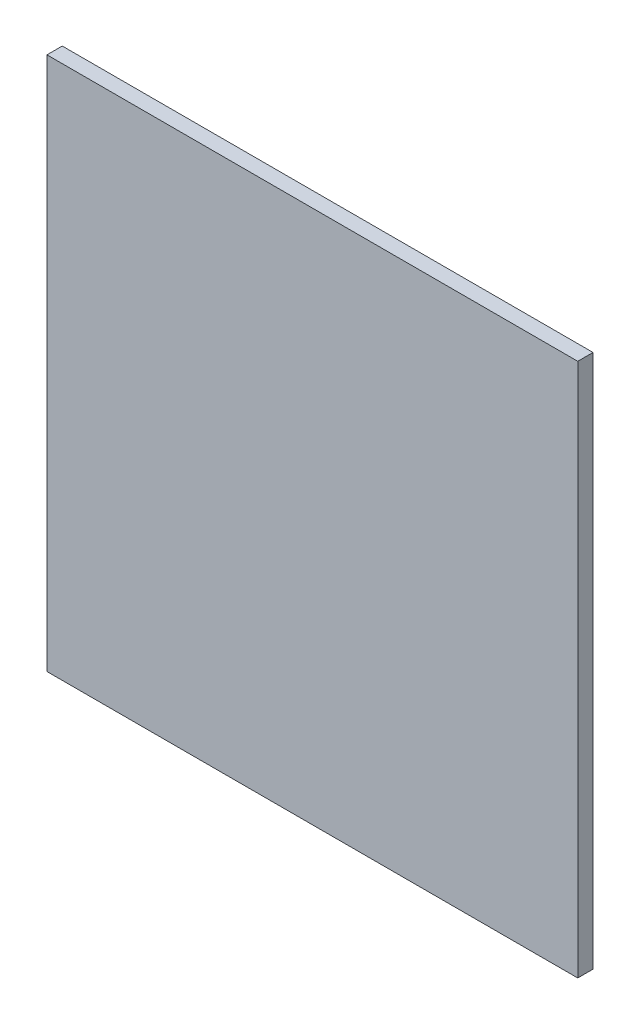
from build123d import *

# Parameters (mm, degrees)
SKETCH1_W           = 88.213257977
SKETCH1_H           = 88.763858177
BOSS_EXTRUDE1_DEPTH = 2.54


with BuildPart() as part:
    # Sketch1 → Boss-Extrude1 (new body)
    with BuildSketch(Plane.XY):
        with Locations((44.106628989, 44.381929089)):
            Rectangle(SKETCH1_W, SKETCH1_H)
    extrude(amount=BOSS_EXTRUDE1_DEPTH)


solid = part.part
